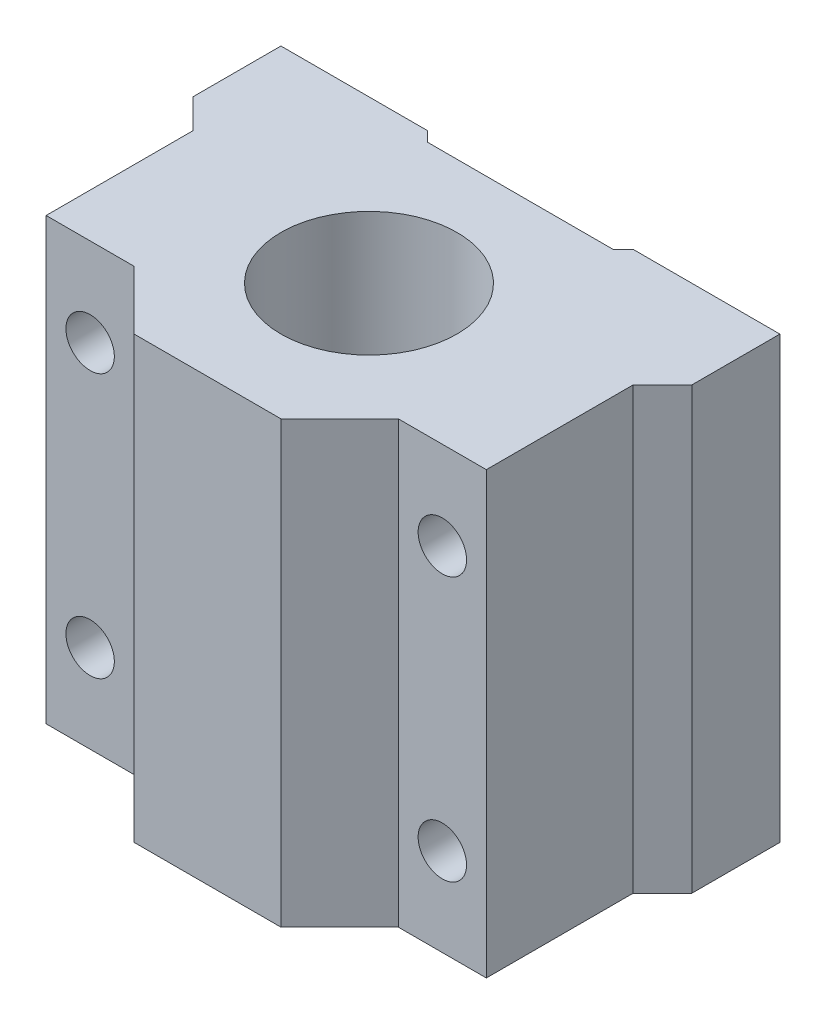
from build123d import *

# Parameters (mm, degrees)
SKETCH1_R           = 6
BOSS_EXTRUDE1_DEPTH = 30
SKETCH2_R           = 1.65
CUT_EXTRUDE1_DEPTH  = 41.902322672
CUT_EXTRUDE2_DEPTH  = 37.193922142


with BuildPart() as part:
    # Sketch1 → Boss-Extrude1 (new body)
    with BuildSketch(Plane(origin=(0, 0, 0), x_dir=(1, 0, 0), z_dir=(0, 1, 0))):
        Polygon((17, 11), (17, 5), (14.998887809, 2.998887809), (14.998887809, -7.001112191), (8.998887809, -7.001112191), (5, -11), (-5, -11), (-8.998887809, -7.001112191), (-14.998887809, -7.001112191), (-14.998887809, 2.998887809), (-17, 5), (-17, 11), align=None)
        with Locations(Location((0, 0, 0), (0, 0, 270))):
            Circle(SKETCH1_R, mode=Mode.SUBTRACT)
    extrude(amount=BOSS_EXTRUDE1_DEPTH)

    # Sketch2 → Cut-Extrude1 (cut, through all)
    with BuildSketch(Plane(origin=(0, 0, -11), x_dir=(-1, 0, 0), z_dir=(0, 0, -1))):
        with Locations((12, 6)):
            Circle(SKETCH2_R)
        with Locations(Location((-12, 6, 0), (0, 0, 180))):
            Circle(SKETCH2_R)
        with Locations((12, 24)):
            Circle(SKETCH2_R)
        with Locations((-12, 24)):
            Circle(SKETCH2_R)
    extrude(amount=-CUT_EXTRUDE1_DEPTH, mode=Mode.SUBTRACT)

    # Sketch3 → Cut-Extrude2 (cut, through all)
    with BuildSketch(Plane.XZ):
        Polygon((-6.31588303, -10.31588303), (6.31588303, -10.31588303), (7, -11), (-7, -11), align=None)
    extrude(amount=-CUT_EXTRUDE2_DEPTH, mode=Mode.SUBTRACT)


solid = part.part
